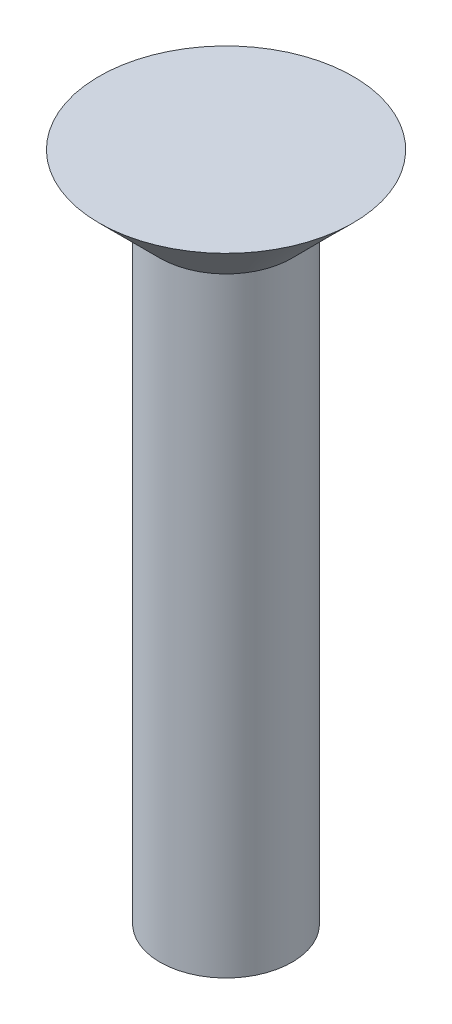
from build123d import *


with BuildPart() as part:
    # Sketch4 → Revolve1 (revolve)
    with BuildSketch(Plane.XY, mode=Mode.PRIVATE) as revolve1_sk:
        Polygon((0, 0), (1.3, 0), (1.3, 12), (2.5, 13.2), (0, 13.2), align=None)
    revolve(revolve1_sk.sketch.rotate(Axis((0, 13.2, 0), (0, -1, 0)), 90), axis=Axis((0, 13.2, 0), (0, -1, 0)))


solid = part.part
